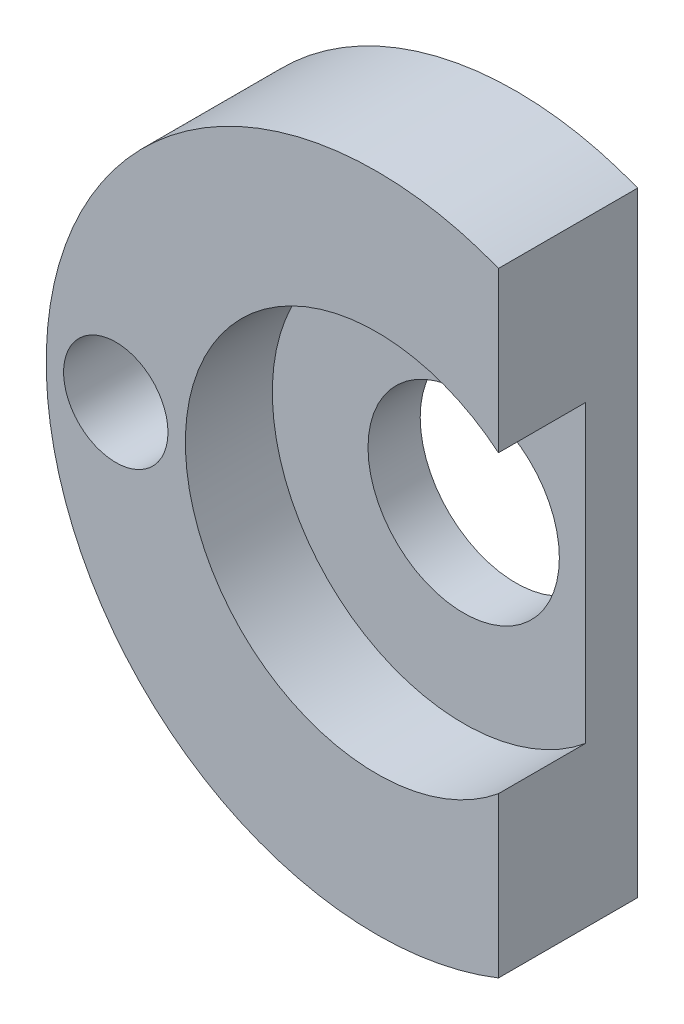
from build123d import *

# Parameters (mm, degrees)
ESQUISSE1_R             = 9.5
ESQUISSE1_R_2           = 2.75
ESQUISSE1_R_3           = 1.5
BOSS_EXTRU_1_DEPTH      = 4
ESQUISSE2_W             = 6
ESQUISSE2_H             = 17.663521732
ENL_V_MAT_EXTRU_1_DEPTH = 15.017845769
ESQUISSE3_R             = 5.5
ENL_V_MAT_EXTRU_2_DEPTH = 2.5


with BuildPart() as part:
    # Esquisse1 → Boss.-Extru.1 (new body)
    with BuildSketch(Plane.XY):
        Circle(ESQUISSE1_R)
        Circle(ESQUISSE1_R_2, mode=Mode.SUBTRACT)
        with Locations((-7.5, 0)):
            Circle(ESQUISSE1_R_3, mode=Mode.SUBTRACT)
    extrude(amount=BOSS_EXTRU_1_DEPTH)

    # Esquisse2 → Enlèv. mat.-Extru.1 (cut, through all)
    with BuildSketch(Plane.XY.offset(4)):
        with Locations((6.5, 0)):
            Rectangle(ESQUISSE2_W, ESQUISSE2_H)
    extrude(amount=-ENL_V_MAT_EXTRU_1_DEPTH, mode=Mode.SUBTRACT)

    # Esquisse3 → Enlèv. mat.-Extru.2 (cut)
    with BuildSketch(Plane.XY.offset(4)):
        Circle(ESQUISSE3_R)
    extrude(amount=-ENL_V_MAT_EXTRU_2_DEPTH, mode=Mode.SUBTRACT)


solid = part.part
